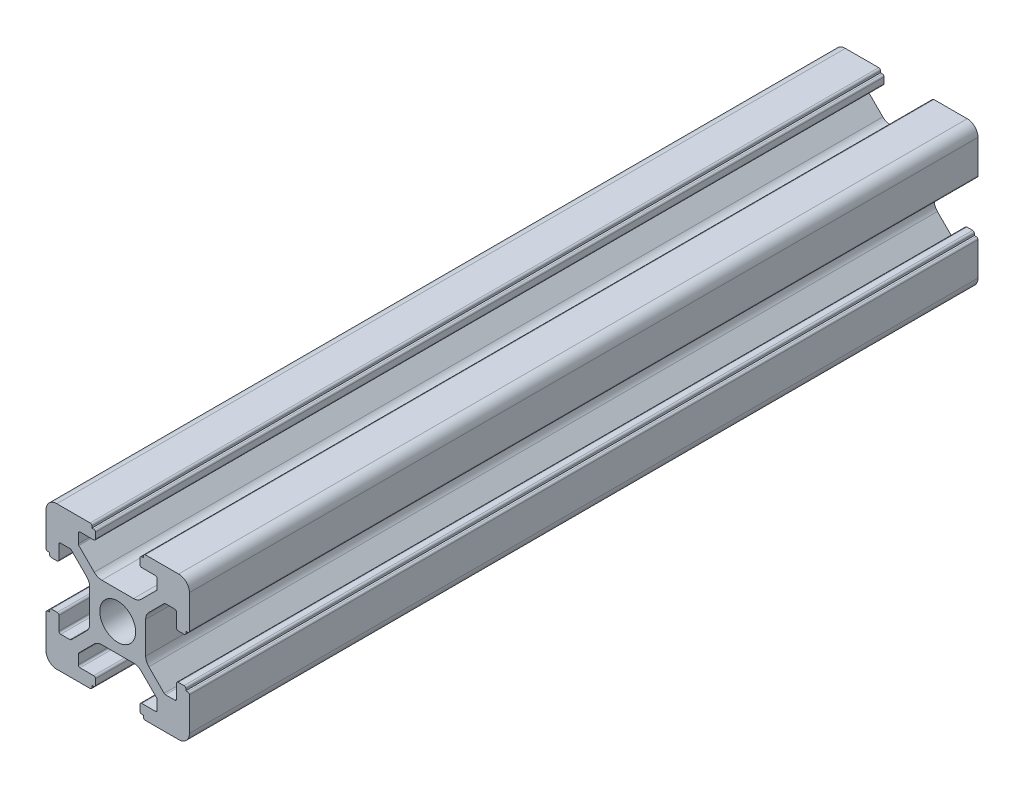
from build123d import *

# Parameters (mm, degrees)
SKETCH_1_R      = 2.5
EXTRUDE_1_DEPTH = 110


with BuildPart() as part:
    # 草图1 → 凸台-拉伸1 (new body)
    with BuildSketch(Plane.XY):
        with BuildLine():
            Line((-8.502261885, -10.002261885), (-3.85, -10.002261885))
            ThreePointArc((-3.85, -10.002261885), (-3.673223305, -9.929038581), (-3.6, -9.752261885))
            Line((-3.6, -9.752261885), (-3.6, -9.502261885))
            Line((-3.6, -9.502261885), (-3.35, -9.502261885))
            ThreePointArc((-3.35, -9.502261885), (-3.173223305, -9.429038581), (-3.1, -9.252261885))
            Line((-3.1, -9.252261885), (-3.1, -8.45))
            ThreePointArc((-3.1, -8.45), (-3.173223305, -8.273223305), (-3.35, -8.2))
            Line((-3.35, -8.2), (-5.25, -8.2))
            ThreePointArc((-5.25, -8.2), (-5.426776695, -8.126776695), (-5.5, -7.95))
            Line((-5.5, -7.95), (-5.5, -6.664213562))
            ThreePointArc((-5.5, -6.664213562), (-5.480969883, -6.568542704), (-5.426776695, -6.487436867))
            Line((-5.426776695, -6.487436867), (-3.278679656, -4.339339828))
            ThreePointArc((-3.278679656, -4.339339828), (-2.792044633, -4.014180701), (-2.218019485, -3.9))
            Line((-2.218019485, -3.9), (2.218019485, -3.9))
            ThreePointArc((2.218019485, -3.9), (2.792044633, -4.014180701), (3.278679656, -4.339339828))
            Line((3.278679656, -4.339339828), (5.426776695, -6.487436867))
            ThreePointArc((5.426776695, -6.487436867), (5.480969883, -6.568542704), (5.5, -6.664213562))
            Line((5.5, -6.664213562), (5.5, -7.95))
            ThreePointArc((5.5, -7.95), (5.426776695, -8.126776695), (5.25, -8.2))
            Line((5.25, -8.2), (3.35, -8.2))
            ThreePointArc((3.35, -8.2), (3.173223305, -8.273223305), (3.1, -8.45))
            Line((3.1, -8.45), (3.1, -9.252261885))
            ThreePointArc((3.1, -9.252261885), (3.173223305, -9.429038581), (3.35, -9.502261885))
            Line((3.35, -9.502261885), (3.6, -9.502261885))
            Line((3.6, -9.502261885), (3.6, -9.752261885))
            ThreePointArc((3.6, -9.752261885), (3.673223305, -9.929038581), (3.85, -10.002261885))
            Line((3.85, -10.002261885), (8.502261885, -10.002261885))
            ThreePointArc((8.502261885, -10.002261885), (9.562922057, -9.562922057), (10.002261885, -8.502261885))
            Line((10.002261885, -8.502261885), (10.002261885, -3.85))
            ThreePointArc((10.002261885, -3.85), (9.929038581, -3.673223305), (9.752261885, -3.6))
            Line((9.752261885, -3.6), (9.502261885, -3.6))
            Line((9.502261885, -3.6), (9.502261885, -3.35))
            ThreePointArc((9.502261885, -3.35), (9.429038581, -3.173223305), (9.252261885, -3.1))
            Line((9.252261885, -3.1), (8.45, -3.1))
            ThreePointArc((8.45, -3.1), (8.273223305, -3.173223305), (8.2, -3.35))
            Line((8.2, -3.35), (8.2, -5.25))
            ThreePointArc((8.2, -5.25), (8.126776695, -5.426776695), (7.95, -5.5))
            Line((7.95, -5.5), (6.664213562, -5.5))
            ThreePointArc((6.664213562, -5.5), (6.568542704, -5.480969883), (6.487436867, -5.426776695))
            Line((6.487436867, -5.426776695), (4.339339828, -3.278679656))
            ThreePointArc((4.339339828, -3.278679656), (4.014180701, -2.792044633), (3.9, -2.218019485))
            Line((3.9, -2.218019485), (3.9, 2.218019485))
            ThreePointArc((3.9, 2.218019485), (4.014180701, 2.792044633), (4.339339828, 3.278679656))
            Line((4.339339828, 3.278679656), (6.487436867, 5.426776695))
            ThreePointArc((6.487436867, 5.426776695), (6.568542704, 5.480969883), (6.664213562, 5.5))
            Line((6.664213562, 5.5), (7.95, 5.5))
            ThreePointArc((7.95, 5.5), (8.126776695, 5.426776695), (8.2, 5.25))
            Line((8.2, 5.25), (8.2, 3.35))
            ThreePointArc((8.2, 3.35), (8.273223305, 3.173223305), (8.45, 3.1))
            Line((8.45, 3.1), (9.252261885, 3.1))
            ThreePointArc((9.252261885, 3.1), (9.429038581, 3.173223305), (9.502261885, 3.35))
            Line((9.502261885, 3.35), (9.502261885, 3.6))
            Line((9.502261885, 3.6), (9.752261885, 3.6))
            ThreePointArc((9.752261885, 3.6), (9.929038581, 3.673223305), (10.002261885, 3.85))
            Line((10.002261885, 3.85), (10.002261885, 8.502261885))
            ThreePointArc((10.002261885, 8.502261885), (9.562922057, 9.562922057), (8.502261885, 10.002261885))
            Line((8.502261885, 10.002261885), (3.85, 10.002261885))
            ThreePointArc((3.85, 10.002261885), (3.673223305, 9.929038581), (3.6, 9.752261885))
            Line((3.6, 9.752261885), (3.6, 9.502261885))
            Line((3.6, 9.502261885), (3.35, 9.502261885))
            ThreePointArc((3.35, 9.502261885), (3.173223305, 9.429038581), (3.1, 9.252261885))
            Line((3.1, 9.252261885), (3.1, 8.45))
            ThreePointArc((3.1, 8.45), (3.173223305, 8.273223305), (3.35, 8.2))
            Line((3.35, 8.2), (5.25, 8.2))
            ThreePointArc((5.25, 8.2), (5.426776695, 8.126776695), (5.5, 7.95))
            Line((5.5, 7.95), (5.5, 6.664213562))
            ThreePointArc((5.5, 6.664213562), (5.480969883, 6.568542704), (5.426776695, 6.487436867))
            Line((5.426776695, 6.487436867), (3.278679656, 4.339339828))
            ThreePointArc((3.278679656, 4.339339828), (2.792044633, 4.014180701), (2.218019485, 3.9))
            Line((2.218019485, 3.9), (-2.218019485, 3.9))
            ThreePointArc((-2.218019485, 3.9), (-2.792044633, 4.014180701), (-3.278679656, 4.339339828))
            Line((-3.278679656, 4.339339828), (-5.426776695, 6.487436867))
            ThreePointArc((-5.426776695, 6.487436867), (-5.480969883, 6.568542704), (-5.5, 6.664213562))
            Line((-5.5, 6.664213562), (-5.5, 7.95))
            ThreePointArc((-5.5, 7.95), (-5.426776695, 8.126776695), (-5.25, 8.2))
            Line((-5.25, 8.2), (-3.35, 8.2))
            ThreePointArc((-3.35, 8.2), (-3.173223305, 8.273223305), (-3.1, 8.45))
            Line((-3.1, 8.45), (-3.1, 9.252261885))
            ThreePointArc((-3.1, 9.252261885), (-3.173223305, 9.429038581), (-3.35, 9.502261885))
            Line((-3.35, 9.502261885), (-3.6, 9.502261885))
            Line((-3.6, 9.502261885), (-3.6, 9.752261885))
            ThreePointArc((-3.6, 9.752261885), (-3.673223305, 9.929038581), (-3.85, 10.002261885))
            Line((-3.85, 10.002261885), (-8.502261885, 10.002261885))
            ThreePointArc((-8.502261885, 10.002261885), (-9.562922057, 9.562922057), (-10.002261885, 8.502261885))
            Line((-10.002261885, 8.502261885), (-10.002261885, 3.85))
            ThreePointArc((-10.002261885, 3.85), (-9.929038581, 3.673223305), (-9.752261885, 3.6))
            Line((-9.752261885, 3.6), (-9.502261885, 3.6))
            Line((-9.502261885, 3.6), (-9.502261885, 3.35))
            ThreePointArc((-9.502261885, 3.35), (-9.429038581, 3.173223305), (-9.252261885, 3.1))
            Line((-9.252261885, 3.1), (-8.45, 3.1))
            ThreePointArc((-8.45, 3.1), (-8.273223305, 3.173223305), (-8.2, 3.35))
            Line((-8.2, 3.35), (-8.2, 5.25))
            ThreePointArc((-8.2, 5.25), (-8.126776695, 5.426776695), (-7.95, 5.5))
            Line((-7.95, 5.5), (-6.664213562, 5.5))
            ThreePointArc((-6.664213562, 5.5), (-6.568542704, 5.480969883), (-6.487436867, 5.426776695))
            Line((-6.487436867, 5.426776695), (-4.339339828, 3.278679656))
            ThreePointArc((-4.339339828, 3.278679656), (-4.014180701, 2.792044633), (-3.9, 2.218019485))
            Line((-3.9, 2.218019485), (-3.9, -2.218019485))
            ThreePointArc((-3.9, -2.218019485), (-4.014180701, -2.792044633), (-4.339339828, -3.278679656))
            Line((-4.339339828, -3.278679656), (-6.487436867, -5.426776695))
            ThreePointArc((-6.487436867, -5.426776695), (-6.568542704, -5.480969883), (-6.664213562, -5.5))
            Line((-6.664213562, -5.5), (-7.95, -5.5))
            ThreePointArc((-7.95, -5.5), (-8.126776695, -5.426776695), (-8.2, -5.25))
            Line((-8.2, -5.25), (-8.2, -3.35))
            ThreePointArc((-8.2, -3.35), (-8.273223305, -3.173223305), (-8.45, -3.1))
            Line((-8.45, -3.1), (-9.252261885, -3.1))
            ThreePointArc((-9.252261885, -3.1), (-9.429038581, -3.173223305), (-9.502261885, -3.35))
            Line((-9.502261885, -3.35), (-9.502261885, -3.6))
            Line((-9.502261885, -3.6), (-9.752261885, -3.6))
            ThreePointArc((-9.752261885, -3.6), (-9.929038581, -3.673223305), (-10.002261885, -3.85))
            Line((-10.002261885, -3.85), (-10.002261885, -8.502261885))
            ThreePointArc((-10.002261885, -8.502261885), (-9.562922057, -9.562922057), (-8.502261885, -10.002261885))
        make_face()
        Circle(SKETCH_1_R, mode=Mode.SUBTRACT)
    extrude(amount=EXTRUDE_1_DEPTH)


solid = part.part
